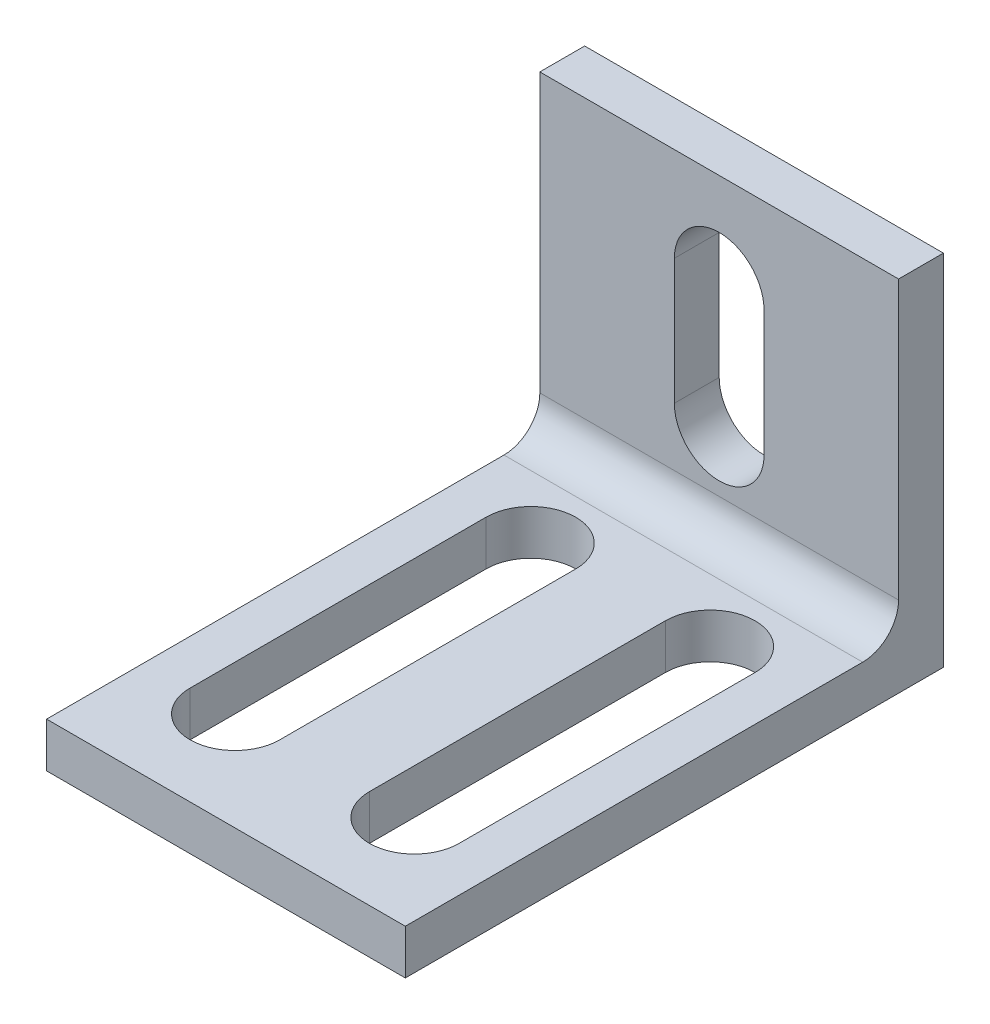
from build123d import *

# Parameters (mm, degrees)
BOSS_EXTRUDE1_DEPTH      = 12.7
BOSS_EXTRUDE1_DEPTH_BACK = 12.7
CUT_EXTRUDE1_DEPTH       = 40.272581084
CUT_EXTRUDE2_DEPTH       = 38.1
FILLET1_R                = 2.54


with BuildPart() as part:
    # Sketch2 → Boss-Extrude1 (new, two sides: drawn at the far end of the back side and taken through both)
    with BuildSketch(Plane(origin=(0, 0, 0), x_dir=(0, 0, -1), z_dir=(1, 0, 0)).offset(-BOSS_EXTRUDE1_DEPTH_BACK)):
        Polygon((15.875, -9.525), (-19.05, -9.525), (-19.05, -12.7), (19.05, -12.7), (19.05, 12.7), (15.875, 12.7), align=None)
    extrude(amount=BOSS_EXTRUDE1_DEPTH + BOSS_EXTRUDE1_DEPTH_BACK)

    # Sketch4 → Cut-Extrude1 (cut, through all)
    with BuildSketch(Plane.XY.offset(-15.875)):
        with BuildLine():
            Line((-3.175, 6.0325), (-3.175, -2.8575))
            ThreePointArc((-3.175, -2.8575), (0, -6.0325), (3.175, -2.8575))
            Line((3.175, -2.8575), (3.175, 6.0325))
            ThreePointArc((3.175, 6.0325), (0, 9.2075), (-3.175, 6.0325))
        make_face()
    extrude(amount=-CUT_EXTRUDE1_DEPTH, mode=Mode.SUBTRACT)

    # Sketch5 → Cut-Extrude2 (cut)
    with BuildSketch(Plane(origin=(0, -9.525, 0), x_dir=(1, 0, 0), z_dir=(0, 1, 0))):
        with BuildLine():
            Line((-3.175, 8.89), (-3.175, -12.065))
            ThreePointArc((-3.175, -12.065), (-6.35, -15.24), (-9.525, -12.065))
            Line((-9.525, -12.065), (-9.525, 8.89))
            ThreePointArc((-9.525, 8.89), (-6.35, 12.065), (-3.175, 8.89))
        make_face()
        with BuildLine():
            Line((3.175, 8.89), (3.175, -12.065))
            ThreePointArc((3.175, -12.065), (6.35, -15.24), (9.525, -12.065))
            Line((9.525, -12.065), (9.525, 8.89))
            ThreePointArc((9.525, 8.89), (6.35, 12.065), (3.175, 8.89))
        make_face()
    extrude(amount=-CUT_EXTRUDE2_DEPTH, mode=Mode.SUBTRACT)

    # Fillet1
    fillet1_edges = [part.edges().sort_by_distance(p)[0] for p in [
        (0, -9.525, -15.875),
    ]]
    fillet(fillet1_edges, radius=FILLET1_R)


solid = part.part
